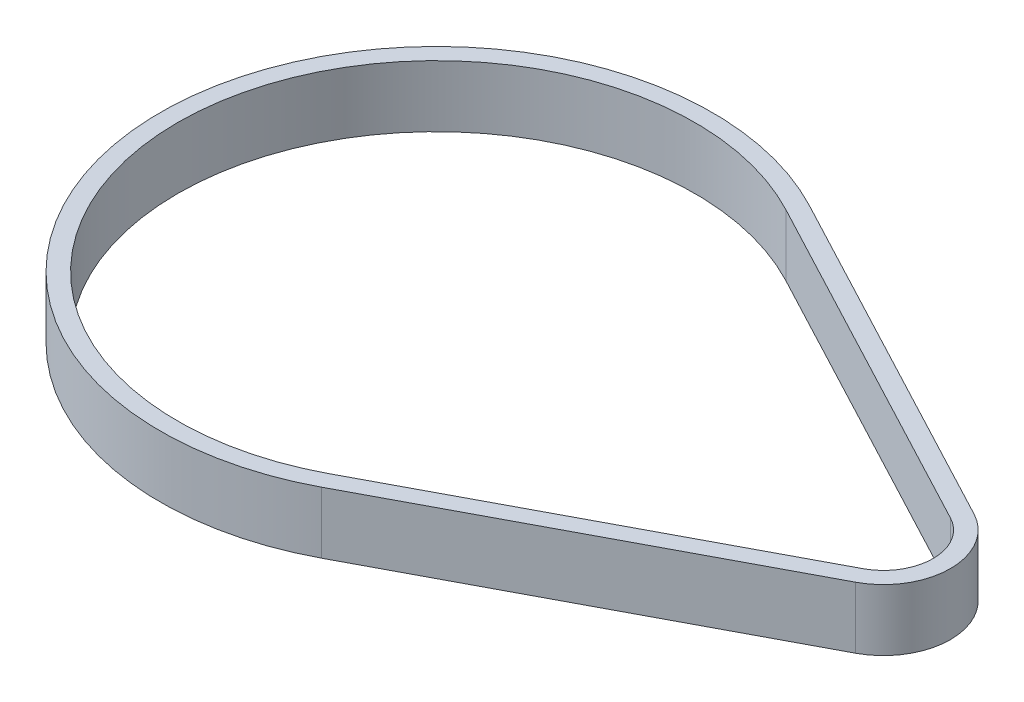
from build123d import *

# Parameters (mm, degrees)
BOSS_EXTRUDE1_DEPTH = 9


with BuildPart() as part:
    # Sketch1 → Boss-Extrude1 (new body)
    with BuildSketch(Plane(origin=(0, 0, 0), x_dir=(1, 0, 0), z_dir=(0, 1, 0))):
        with BuildLine():
            Line((18.869503478, 35.682980025), (69.981549958, 8.654437618))
            ThreePointArc((69.981549958, 8.654437618), (75.195, 0), (69.981549958, -8.654437618))
            Line((69.981549958, -8.654437618), (18.869503478, -35.682980025))
            ThreePointArc((18.869503478, -35.682980025), (-40.365, 0), (18.869503478, 35.682980025))
        make_face()
        with BuildLine():
            Line((17.682124838, 33.437599887), (68.794171317, 6.40905748))
            ThreePointArc((68.794171317, 6.40905748), (72.655, 0), (68.794171317, -6.40905748))
            Line((68.794171317, -6.40905748), (17.682124838, -33.437599887))
            ThreePointArc((17.682124838, -33.437599887), (-37.825, 0), (17.682124838, 33.437599887))
        make_face(mode=Mode.SUBTRACT)
    extrude(amount=BOSS_EXTRUDE1_DEPTH)


solid = part.part
